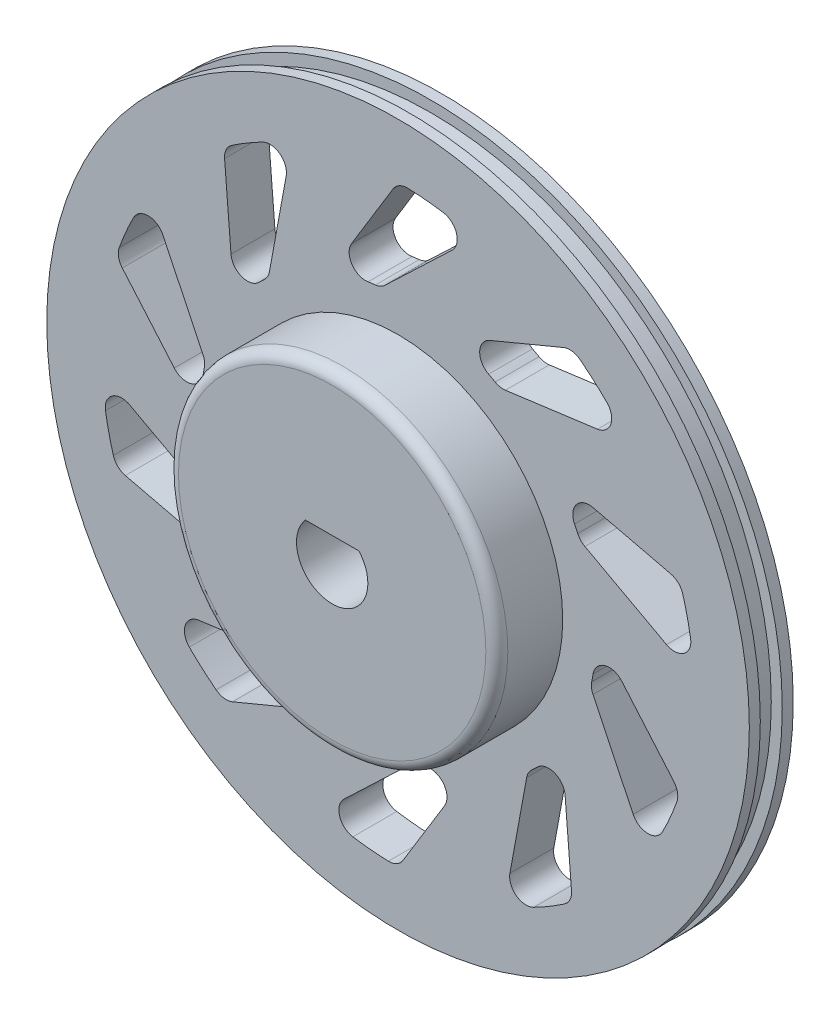
from build123d import *

# Parameters (mm, degrees)
SKETCH_1_R          = 31
EXTRUDE_2_DEPTH     = 2
SKETCH_2_R          = 32
EXTRUDE_3_DEPTH     = 1
EXTRUDE_START       = 1
SKETCH_3_R          = 32
EXTRUDE_4_DEPTH     = 1
SKETCH_6_R          = 15
EXTRUDE_6_DEPTH     = 6
CUT_EXTRUDE_4_DEPTH = 47.346520905
CUT_EXTRUDE_5_DEPTH = 46.650848842
FILLET_1_R          = 1


with BuildPart() as part:
    # Эскиз1 → Бобышка-Вытянуть2 (new body)
    with BuildSketch(Plane.XY):
        Circle(SKETCH_1_R)
    extrude(amount=EXTRUDE_2_DEPTH)

    # Эскиз2 → Бобышка-Вытянуть3 (add)
    with BuildSketch(Plane.XY.offset(2)):
        Circle(SKETCH_2_R)
    extrude(amount=EXTRUDE_3_DEPTH)

    # Эскиз3 → Бобышка-Вытянуть4 (add)
    with BuildSketch(Plane(origin=(0, 0, 0), x_dir=(-1, 0, 0), z_dir=(0, 0, -1)).offset(EXTRUDE_START)):
        with Locations(Location((0, 0, 0), (0, 0, 180))):
            Circle(SKETCH_3_R)
    extrude(amount=-EXTRUDE_4_DEPTH)

    # Эскиз6 → Бобышка-Вытянуть6 (add)
    with BuildSketch(Plane.XY.offset(3)):
        Circle(SKETCH_6_R)
    extrude(amount=EXTRUDE_6_DEPTH)

    # Эскиз4 → Вырез-Вытянуть4 (cut, through all)
    with BuildSketch(Plane(origin=(0, 0, -1), x_dir=(-1, 0, 0), z_dir=(0, 0, -1))):
        with BuildLine():
            Line((2.437211521, 2.15), (-2.437211521, 2.15))
            ThreePointArc((-2.437211521, 2.15), (0, -3.25), (2.437211521, 2.15))
        make_face()
    extrude(amount=-CUT_EXTRUDE_4_DEPTH, mode=Mode.SUBTRACT)

    # Эскиз7 → Вырез-Вытянуть5 (cut, through all)
    with BuildSketch(Plane.XY.offset(3)):
        with BuildLine():
            Line((-1.196907114, 18.285650075), (4.924848525, 24.115212052))
            ThreePointArc((4.924848525, 24.115212052), (5.321696385, 25.650338094), (4.119277954, 26.683919299))
            ThreePointArc((4.119277954, 26.683919299), (2.505413728, 26.883506134), (0.882461302, 26.985575074))
            ThreePointArc((0.882461302, 26.985575074), (0.120845833, 26.806306653), (-0.446883349, 26.267902657))
            Line((-0.446883349, 26.267902657), (-4.238854139, 20.055785457))
            ThreePointArc((-4.238854139, 20.055785457), (-4.207002942, 18.442797843), (-2.730955491, 17.791623931))
            ThreePointArc((-2.730955491, 17.791623931), (-2.395744761, 17.839854457), (-2.059685964, 17.881769871))
            ThreePointArc((-2.059685964, 17.881769871), (-1.595382366, 18.013397906), (-1.196907114, 18.285650075))
        make_face()
        with BuildLine():
            Line((8.35918988, 18.717007219), (15.078349566, 21.513851098))
            ThreePointArc((15.078349566, 21.513851098), (15.854118052, 21.61572624), (16.575649243, 21.313091099))
            ThreePointArc((16.575649243, 21.313091099), (17.828650719, 20.276568091), (19.016980106, 19.166493358))
            ThreePointArc((19.016980106, 19.166493358), (19.382233263, 17.623544777), (18.158852151, 16.61486304))
            Line((18.158852151, 16.61486304), (9.779717246, 15.496926014))
            ThreePointArc((9.779717246, 15.496926014), (9.297318186, 15.510887259), (8.844319668, 15.677308749))
            ThreePointArc((8.844319668, 15.677308749), (8.547805127, 15.840928871), (8.248264758, 15.99894148))
            ThreePointArc((8.248264758, 15.99894148), (7.436867708, 17.393351165), (8.35918988, 18.717007219))
        make_face()
        with BuildLine():
            Line((17.764307483, 10.228968392), (24.844165441, 8.542239649))
            ThreePointArc((24.844165441, 8.542239649), (25.531656036, 8.168673095), (25.937502559, 7.499730729))
            ThreePointArc((25.937502559, 7.499730729), (26.341949109, 5.924670212), (26.650842222, 4.328118399))
            ThreePointArc((26.650842222, 4.328118399), (26.039415812, 2.865156358), (24.456791453, 2.768201066))
            Line((24.456791453, 2.768201066), (17.020822019, 6.788902937))
            ThreePointArc((17.020822019, 6.788902937), (16.638759195, 7.083744875), (16.370095793, 7.484648537))
            ThreePointArc((16.370095793, 7.484648537), (16.226383986, 7.791306871), (16.076928218, 8.095207168))
            ThreePointArc((16.076928218, 8.095207168), (16.240107663, 9.700235519), (17.764307483, 10.228968392))
        make_face()
        with BuildLine():
            Line((20.384063414, -2.166188691), (25.12035454, -7.692217006))
            ThreePointArc((25.12035454, -7.692217006), (25.456969204, -8.398535529), (25.392111481, -9.178271872))
            ThreePointArc((25.392111481, -9.178271872), (24.79351827, -10.690250315), (24.104988437, -12.16345068))
            ThreePointArc((24.104988437, -12.16345068), (22.750426568, -12.987624407), (21.413067675, -12.135819628))
            Line((21.413067675, -12.135819628), (17.760551297, -4.512250316))
            ThreePointArc((17.760551297, -4.512250316), (17.624759723, -4.049147284), (17.643051725, -3.566893022))
            ThreePointArc((17.643051725, -3.566893022), (17.707035676, -3.234329538), (17.764751533, -2.900621137))
            ThreePointArc((17.764751533, -2.900621137), (18.840178472, -1.698040395), (20.384063414, -2.166188691))
        make_face()
        with BuildLine():
            Line((15.21779995, -13.733935321), (15.801422014, -20.988508213))
            ThreePointArc((15.801422014, -20.988508213), (15.658585386, -21.757789037), (15.147796863, -22.350486576))
            ThreePointArc((15.147796863, -22.350486576), (13.774806152, -23.221858571), (12.351848368, -24.00899502))
            ThreePointArc((12.351848368, -24.00899502), (10.771547634, -23.879574082), (10.190279849, -22.404369706))
            Line((10.190279849, -22.404369706), (11.716353639, -14.089877314))
            ThreePointArc((11.716353639, -14.089877314), (11.87870108, -13.635402806), (12.176961563, -13.256002682))
            ThreePointArc((12.176961563, -13.256002682), (12.424201579, -13.024561994), (12.667043564, -12.788510755))
            ThreePointArc((12.667043564, -12.788510755), (14.243941459, -12.447722593), (15.21779995, -13.733935321))
        make_face()
        with BuildLine():
            Line((4.238854139, -20.055785457), (0.446883349, -26.267902657))
            ThreePointArc((0.446883349, -26.267902657), (-0.120845833, -26.806306653), (-0.882461302, -26.985575074))
            ThreePointArc((-0.882461302, -26.985575074), (-2.505413728, -26.883506134), (-4.119277954, -26.683919299))
            ThreePointArc((-4.119277954, -26.683919299), (-5.321696385, -25.650338094), (-4.924848525, -24.115212052))
            Line((-4.924848525, -24.115212052), (1.196907114, -18.285650075))
            ThreePointArc((1.196907114, -18.285650075), (1.595382366, -18.013397906), (2.059685964, -17.881769871))
            ThreePointArc((2.059685964, -17.881769871), (2.395744761, -17.839854457), (2.730955491, -17.791623931))
            ThreePointArc((2.730955491, -17.791623931), (4.207002942, -18.442797843), (4.238854139, -20.055785457))
        make_face()
        with BuildLine():
            Line((-8.35918988, -18.717007219), (-15.078349566, -21.513851098))
            ThreePointArc((-15.078349566, -21.513851098), (-15.854118052, -21.61572624), (-16.575649243, -21.313091099))
            ThreePointArc((-16.575649243, -21.313091099), (-17.828650719, -20.276568091), (-19.016980106, -19.166493358))
            ThreePointArc((-19.016980106, -19.166493358), (-19.382233263, -17.623544777), (-18.158852151, -16.61486304))
            Line((-18.158852151, -16.61486304), (-9.779717246, -15.496926014))
            ThreePointArc((-9.779717246, -15.496926014), (-9.297318186, -15.510887259), (-8.844319668, -15.677308749))
            ThreePointArc((-8.844319668, -15.677308749), (-8.547805127, -15.840928871), (-8.248264758, -15.99894148))
            ThreePointArc((-8.248264758, -15.99894148), (-7.436867708, -17.393351165), (-8.35918988, -18.717007219))
        make_face()
        with BuildLine():
            Line((-17.764307483, -10.228968392), (-24.844165441, -8.542239649))
            ThreePointArc((-24.844165441, -8.542239649), (-25.531656036, -8.168673095), (-25.937502559, -7.499730729))
            ThreePointArc((-25.937502559, -7.499730729), (-26.341949109, -5.924670212), (-26.650842222, -4.328118399))
            ThreePointArc((-26.650842222, -4.328118399), (-26.039415812, -2.865156358), (-24.456791453, -2.768201066))
            Line((-24.456791453, -2.768201066), (-17.020822019, -6.788902937))
            ThreePointArc((-17.020822019, -6.788902937), (-16.638759195, -7.083744875), (-16.370095793, -7.484648537))
            ThreePointArc((-16.370095793, -7.484648537), (-16.226383986, -7.791306871), (-16.076928218, -8.095207168))
            ThreePointArc((-16.076928218, -8.095207168), (-16.240107663, -9.700235519), (-17.764307483, -10.228968392))
        make_face()
        with BuildLine():
            Line((-20.384063414, 2.166188691), (-25.12035454, 7.692217006))
            ThreePointArc((-25.12035454, 7.692217006), (-25.456969204, 8.398535529), (-25.392111481, 9.178271872))
            ThreePointArc((-25.392111481, 9.178271872), (-24.79351827, 10.690250315), (-24.104988437, 12.16345068))
            ThreePointArc((-24.104988437, 12.16345068), (-22.750426568, 12.987624407), (-21.413067675, 12.135819628))
            Line((-21.413067675, 12.135819628), (-17.760551297, 4.512250316))
            ThreePointArc((-17.760551297, 4.512250316), (-17.624759723, 4.049147284), (-17.643051725, 3.566893022))
            ThreePointArc((-17.643051725, 3.566893022), (-17.707035676, 3.234329538), (-17.764751533, 2.900621137))
            ThreePointArc((-17.764751533, 2.900621137), (-18.840178472, 1.698040395), (-20.384063414, 2.166188691))
        make_face()
        with BuildLine():
            Line((-15.21779995, 13.733935321), (-15.801422014, 20.988508213))
            ThreePointArc((-15.801422014, 20.988508213), (-15.658585386, 21.757789037), (-15.147796863, 22.350486576))
            ThreePointArc((-15.147796863, 22.350486576), (-13.774806152, 23.221858571), (-12.351848368, 24.00899502))
            ThreePointArc((-12.351848368, 24.00899502), (-10.771547634, 23.879574082), (-10.190279849, 22.404369706))
            Line((-10.190279849, 22.404369706), (-11.716353639, 14.089877314))
            ThreePointArc((-11.716353639, 14.089877314), (-11.87870108, 13.635402806), (-12.176961563, 13.256002682))
            ThreePointArc((-12.176961563, 13.256002682), (-12.424201579, 13.024561994), (-12.667043564, 12.788510755))
            ThreePointArc((-12.667043564, 12.788510755), (-14.243941459, 12.447722593), (-15.21779995, 13.733935321))
        make_face()
    extrude(amount=-CUT_EXTRUDE_5_DEPTH, mode=Mode.SUBTRACT)

    # Скругление1
    fillet_1_edges = [part.edges().sort_by_distance(p)[0] for p in [
        (-15, 0, 9),
    ]]
    fillet(fillet_1_edges, radius=FILLET_1_R)


solid = part.part
